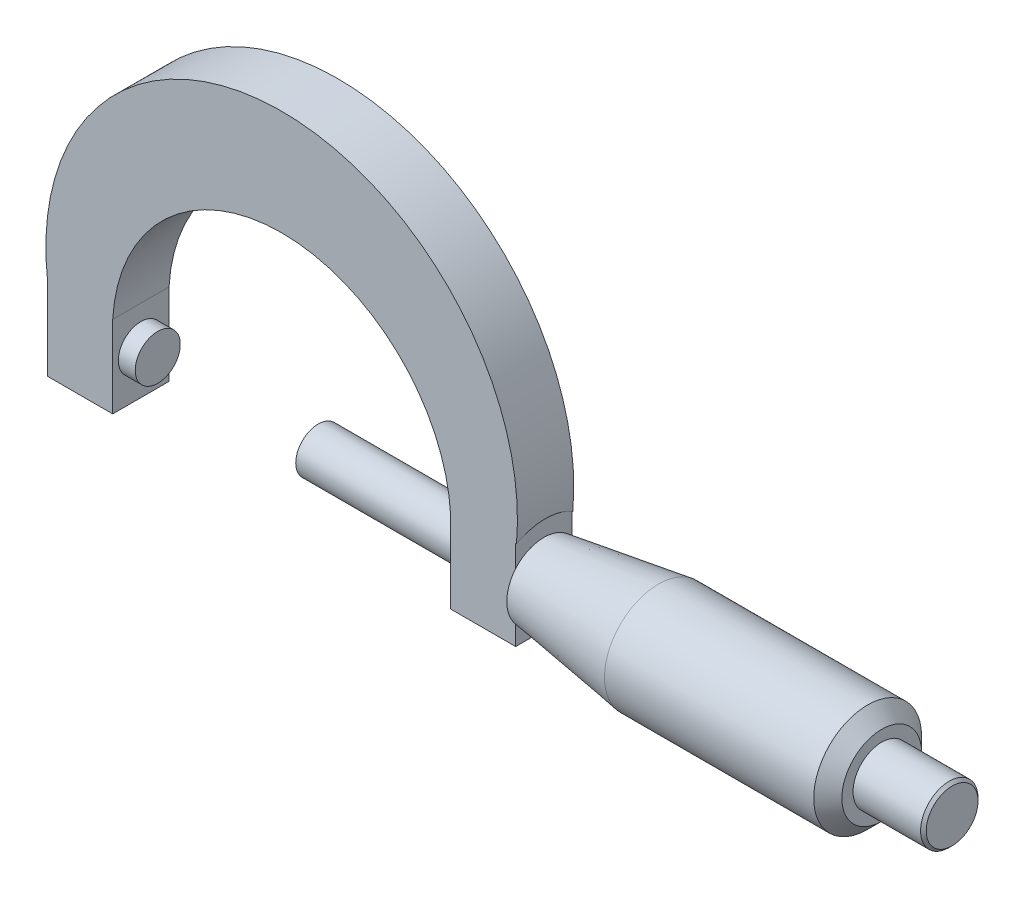
from build123d import *

# Parameters (mm, degrees)
BOSS_EXTRUDE1_DEPTH = 2.54
SKETCH3_R           = 4.865340766
BOSS_EXTRUDE2_DEPTH = 30.48
CHAMFER5_SIZE       = 1.27
SKETCH5_R           = 2.590082511
BOSS_EXTRUDE3_DEPTH = 6.35
CHAMFER6_SIZE       = 0.254
SKETCH6_R           = 2.032
BOSS_EXTRUDE4_DEPTH = 1.524
BOSS_EXTRUDE5_START = 14.478
SKETCH7_R           = 2.032
BOSS_EXTRUDE5_DEPTH = 14.478


with BuildPart() as part:
    # Sketch2 → Boss-Extrude1 (new, symmetric)
    with BuildSketch(Plane.XY):
        with BuildLine():
            Line((-21.110510204, -3.916551019), (-15.24, -3.916551019))
            Line((-15.24, -3.916551019), (-15.24, 3.470183675))
            ThreePointArc((-15.24, 3.470183675), (-10.479530006, 13.693144777), (0, 17.858533009))
            Line((0, 17.858533009), (0, 27.35528296))
            ThreePointArc((0, 27.35528296), (-15.938566505, 20.170697643), (-21.110510204, 3.470183675))
            Line((-21.110510204, 3.470183675), (-21.110510204, -3.916551019))
        make_face()
    boss_extrude1 = extrude(amount=BOSS_EXTRUDE1_DEPTH, both=True)

    # Mirror1: Boss-Extrude1 across plane
    add(boss_extrude1.mirror(Plane(origin=(0, 0, 0), x_dir=(0, 0, 1), z_dir=(1, 0, 0))))

    # Sketch3 → Boss-Extrude2 (add)
    with BuildSketch(Plane(origin=(21.110510204, 0, 0), x_dir=(0, 0, -1), z_dir=(1, 0, 0))):
        with Locations(Location((0, 0, 0), (0, 0, 121.470536691))):
            Circle(SKETCH3_R)
    extrude(amount=BOSS_EXTRUDE2_DEPTH)

    # Sketch4 → Cut-Revolve1 (revolve, cut)
    with BuildSketch(Plane.XY, mode=Mode.PRIVATE) as cut_revolve1_sk:
        Polygon((21.110510204, 3.342420759), (21.110510204, 4.865340766), (31.445897446, 4.865340766), align=None)
    revolve(cut_revolve1_sk.sketch.rotate(Axis((51.590510204, 0, 0), (-1, 0, 0)), 90), axis=Axis((51.590510204, 0, 0), (-1, 0, 0)), mode=Mode.SUBTRACT)

    # Chamfer5
    chamfer5_edges = [part.edges().sort_by_distance(p)[0] for p in [
        (51.590510204, -4.149691648, -2.54),
    ]]
    chamfer(chamfer5_edges, length=CHAMFER5_SIZE)

    # Sketch5 → Boss-Extrude3 (add)
    with BuildSketch(Plane(origin=(51.590510204, 0, 0), x_dir=(0, 0, -1), z_dir=(1, 0, 0))):
        Circle(SKETCH5_R)
    extrude(amount=BOSS_EXTRUDE3_DEPTH)

    # Chamfer6
    chamfer6_edges = [part.edges().sort_by_distance(p)[0] for p in [
        (57.940510204, 0, 2.590082511),
    ]]
    chamfer(chamfer6_edges, length=CHAMFER6_SIZE)

    # Sketch6 → Boss-Extrude4 (add)
    with BuildSketch(Plane(origin=(-15.24, 0, 0), x_dir=(0, 0, -1), z_dir=(1, 0, 0))):
        with Locations(Location((0, 0, 0), (0, 0, 180))):
            Circle(SKETCH6_R)
    extrude(amount=BOSS_EXTRUDE4_DEPTH)

    # Sketch7 → Boss-Extrude5 (add)
    with BuildSketch(Plane.ZY.offset(-15.24).offset(BOSS_EXTRUDE5_START)):
        Circle(SKETCH7_R)
    extrude(amount=-BOSS_EXTRUDE5_DEPTH)


solid = part.part
